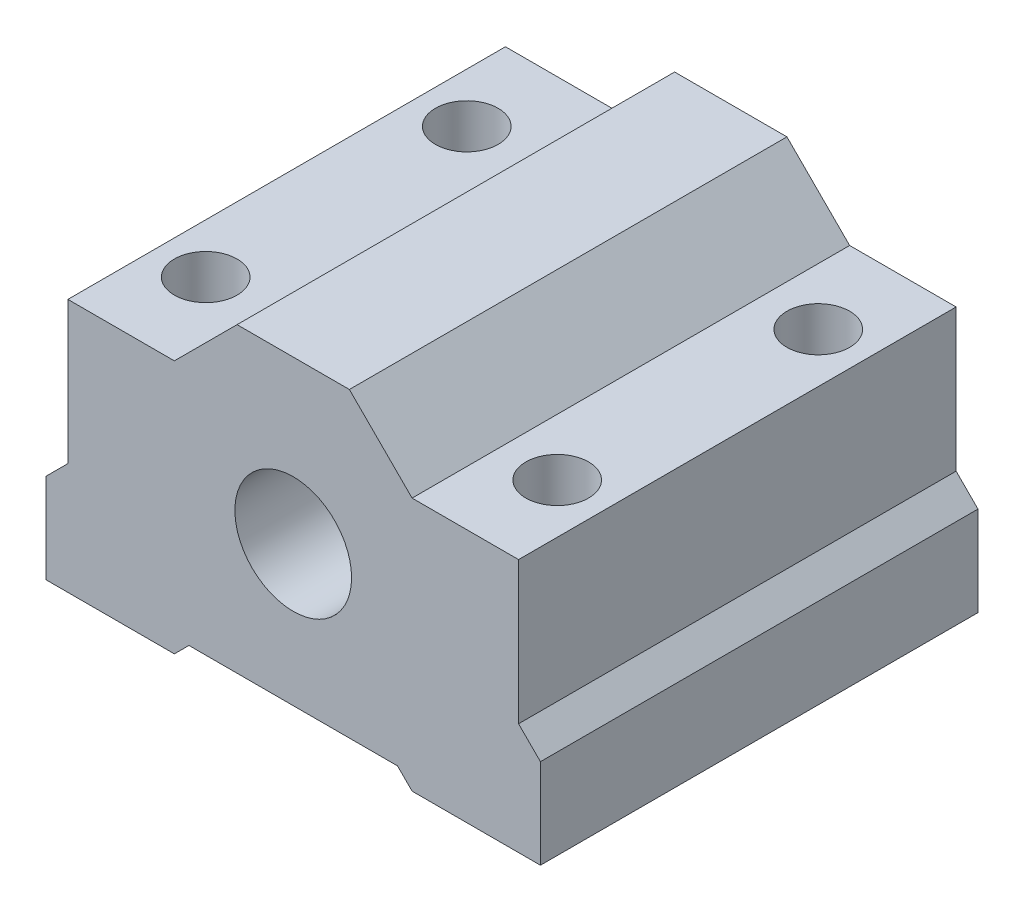
from build123d import *

# Parameters (mm, degrees)
SKETCH1_R                                            = 4
BOSS_EXTRUDE1_DEPTH                                  = 30
CSK_FOR_M4_HEX_SOCKET_COUNTERSUNK_CAP_SC_D           = 4.3
CSK_FOR_M4_HEX_SOCKET_COUNTERSUNK_CAP_SC_CSINK_D     = 5.96
CSK_FOR_M4_HEX_SOCKET_COUNTERSUNK_CAP_SC_CSINK_ANGLE = 90


with BuildPart() as part:
    # Sketch1 → Boss-Extrude1 (new body)
    with BuildSketch(Plane.XY):
        Polygon((0, 0), (0, 6.15), (1.5, 7.65), (1.5, 17.4), (8.8, 17.4), (13.1, 21.7), (20.8, 21.7), (25.1, 17.4), (32.4, 17.4), (32.4, 7.65), (33.9, 6.15), (33.9, 0), (25.1, 0), (24.1, 1), (9.8, 1), (8.8, 0), align=None)
        with Locations((16.95, 10.6)):
            Circle(SKETCH1_R, mode=Mode.SUBTRACT)
    extrude(amount=BOSS_EXTRUDE1_DEPTH)

    # CSK for M4 Hex Socket Countersunk Cap Screw1 (through all)
    with Locations(Plane(origin=(0, 0, 0), x_dir=(-1, 0, 0), z_dir=(0, -1, 0))):
        with Locations((-4.9, -6.05), (-4.9, -23.95), (-29, -6.05), (-29, -23.95)):
            CounterSinkHole(CSK_FOR_M4_HEX_SOCKET_COUNTERSUNK_CAP_SC_D / 2, CSK_FOR_M4_HEX_SOCKET_COUNTERSUNK_CAP_SC_CSINK_D / 2, counter_sink_angle=CSK_FOR_M4_HEX_SOCKET_COUNTERSUNK_CAP_SC_CSINK_ANGLE)


solid = part.part
